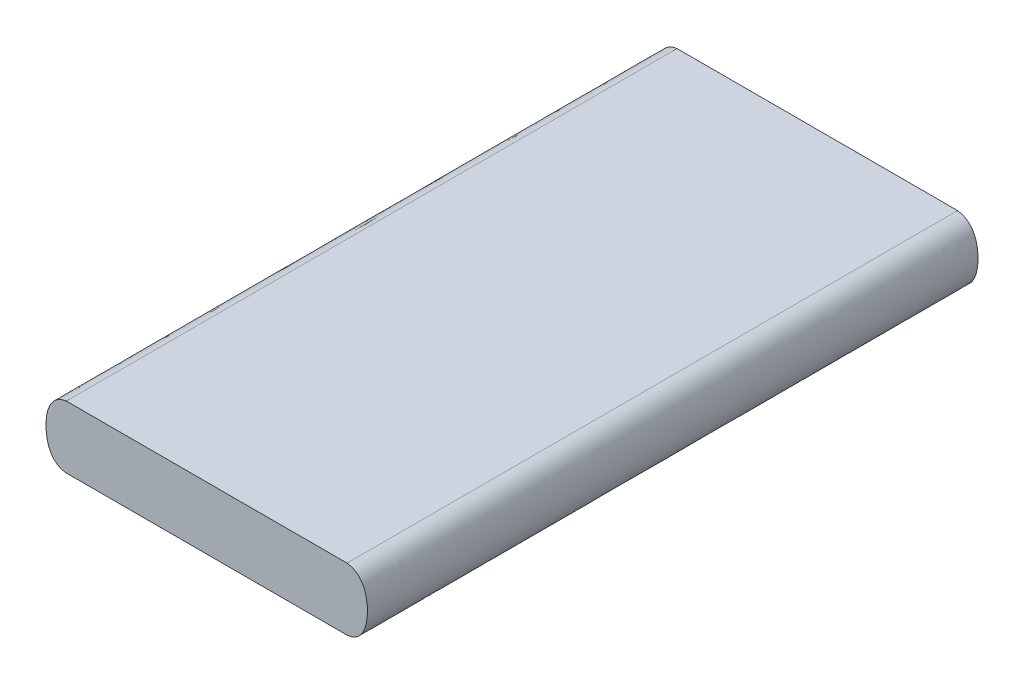
from build123d import *

# Parameters (mm, degrees)
BOSS_EXTRUDE1_DEPTH = 142


with BuildPart() as part:
    # Sketch1 → Boss-Extrude1 (new body)
    with BuildSketch(Plane.XY):
        with BuildLine():
            Line((4.742883085, 0), (70.007116915, 0))
            add(Edge.make_bspline(
                [(70.007116915, 14.5), (73.519848558, 14.04954467), (75.979766631, 7.347012858), (73.520618179, 0.256429615), (70.007116915, 0)],
                knots=[0, 0, 0, 0, 0.5, 1, 1, 1, 1], degree=3))
            Line((70.007116915, 14.5), (4.742883085, 14.5))
            add(Edge.make_bspline(
                [(4.742883085, 14.5), (1.230151442, 14.04954467), (-1.229766631, 7.347012858), (1.229381821, 0.256429615), (4.742883085, 0)],
                knots=[0, 0, 0, 0, 0.5, 1, 1, 1, 1], degree=3))
        make_face()
    extrude(amount=BOSS_EXTRUDE1_DEPTH)


solid = part.part
